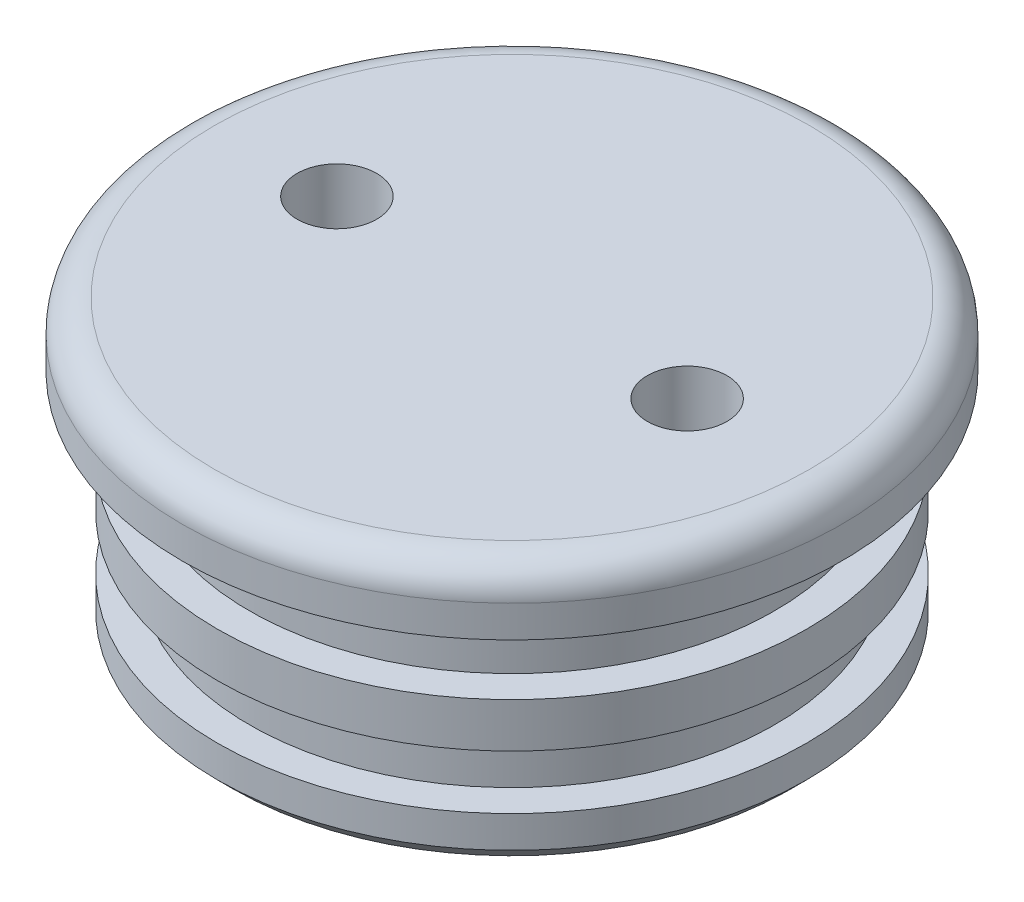
from build123d import *

# Parameters (mm, degrees)
SKETCH_1_R          = 11
EXTRUDE_1_DEPTH     = 9
SKETCH_2_R          = 0.5
CUT_EXTRUDE_1_DEPTH = 18.972200756
SKETCH_3_R          = 16.549134696
SKETCH_3_R_2        = 9.25
CUT_EXTRUDE_2_DEPTH = 7
SKETCH_4_W          = 2
SKETCH_4_H          = 1.7
SKETCH_5_W          = 5
SKETCH_5_H          = 6
CUT_EXTRUDE_3_DEPTH = 7
SKETCH_6_R          = 1.4
CUT_EXTRUDE_4_DEPTH = 7
SKETCH_7_R          = 1.25
CUT_EXTRUDE_5_DEPTH = 2.5
CUT_EXTRUDE_START   = -1.5
SKETCH_8_R          = 1.25
CUT_EXTRUDE_6_DEPTH = 1.5
SKETCH_9_W          = 7
SKETCH_9_H          = 8
SKETCH_9_W_2        = 5
SKETCH_9_H_2        = 6
CUT_EXTRUDE_7_DEPTH = 2
CHAMFER_1_SIZE      = 0.5
SKETCH_10_R         = 12.5
SKETCH_10_R_2       = 10.35
CUT_EXTRUDE_8_DEPTH = 10
FILLET_1_R          = 1
SKETCH_11_R         = 1.953999565
EXTRUDE_2_DEPTH     = 2


with BuildPart() as part:
    # 草图1 → 凸台-拉伸1 (new body)
    with BuildSketch(Plane(origin=(0, 0, 0), x_dir=(1, 0, 0), z_dir=(0, 1, 0))):
        with Locations(Location((0, 0, 0), (0, 0, 270))):
            Circle(SKETCH_1_R)
    extrude(amount=EXTRUDE_1_DEPTH)

    # 草图2 → 切除-拉伸1 (cut, through all)
    with BuildSketch(Plane(origin=(0, 9, 0), x_dir=(1, 0, 0), z_dir=(0, 1, 0))):
        with Locations(Location((-5.5, 0, 0), (0, 0, 270))):
            Circle(SKETCH_2_R)
        with Locations(Location((5.5, 0, 0), (0, 0, 270))):
            Circle(SKETCH_2_R)
    extrude(amount=-CUT_EXTRUDE_1_DEPTH, mode=Mode.SUBTRACT)

    # 草图3 → 切除-拉伸2 (cut)
    with BuildSketch(Plane.XZ):
        Circle(SKETCH_3_R)
        with Locations(Location((0, 0, 0), (0, 0, 270))):
            Circle(SKETCH_3_R_2, mode=Mode.SUBTRACT)
    extrude(amount=-CUT_EXTRUDE_2_DEPTH, mode=Mode.SUBTRACT)

    # 草图4 → 切除-旋转1 (revolve, cut)
    with BuildSketch(Plane.XY, mode=Mode.PRIVATE) as cut_revolve_1_sk:
        with Locations((-9.25, 5.45)):
            Rectangle(SKETCH_4_W, SKETCH_4_H)
        with Locations((-9.25, 2.35)):
            Rectangle(SKETCH_4_W, SKETCH_4_H)
    revolve(cut_revolve_1_sk.sketch.rotate(Axis((0, 0, 0), (0, 1, 0)), 270), axis=Axis((0, 0, 0), (0, 1, 0)), mode=Mode.SUBTRACT)

    # 草图5 → 切除-拉伸3 (cut)
    with BuildSketch(Plane.XZ):
        Rectangle(SKETCH_5_W, SKETCH_5_H)
    extrude(amount=-CUT_EXTRUDE_3_DEPTH, mode=Mode.SUBTRACT)

    # 草图6 → 切除-拉伸4 (cut)
    with BuildSketch(Plane(origin=(0, 9, 0), x_dir=(1, 0, 0), z_dir=(0, 1, 0))):
        with Locations(Location((0, 0, 0), (0, 0, 270))):
            Circle(SKETCH_6_R)
    extrude(amount=-CUT_EXTRUDE_4_DEPTH, mode=Mode.SUBTRACT)

    # 草图7 → 切除-拉伸5 (cut)
    with BuildSketch(Plane(origin=(0, 9, 0), x_dir=(1, 0, 0), z_dir=(0, 1, 0))):
        with Locations(Location((-5.5, 0, 0), (0, 0, 270))):
            Circle(SKETCH_7_R)
        with Locations(Location((5.5, 0, 0), (0, 0, 270))):
            Circle(SKETCH_7_R)
    extrude(amount=-CUT_EXTRUDE_5_DEPTH, mode=Mode.SUBTRACT)

    # 草图8 → 切除-拉伸6 (cut)
    with BuildSketch(Plane.XZ.offset(CUT_EXTRUDE_START)):
        with Locations(Location((-5.5, 0, 0), (0, 0, 90))):
            Circle(SKETCH_8_R)
        with Locations(Location((5.5, 0, 0), (0, 0, 90))):
            Circle(SKETCH_8_R)
    extrude(amount=CUT_EXTRUDE_6_DEPTH, mode=Mode.SUBTRACT)

    # 草图9 → 切除-拉伸7 (cut)
    with BuildSketch(Plane.XZ):
        Rectangle(SKETCH_9_W, SKETCH_9_H)
        Rectangle(SKETCH_9_W_2, SKETCH_9_H_2, mode=Mode.SUBTRACT)
    extrude(amount=-CUT_EXTRUDE_7_DEPTH, mode=Mode.SUBTRACT)

    # 倒角1
    chamfer_1_edges = [part.edges().sort_by_distance(p)[0] for p in [
        (0, 0, 9.25),
    ]]
    chamfer(chamfer_1_edges, length=CHAMFER_1_SIZE)

    # 草图10 → 切除-拉伸8 (cut)
    with BuildSketch(Plane(origin=(0, 9, 0), x_dir=(1, 0, 0), z_dir=(0, 1, 0))):
        Circle(SKETCH_10_R)
        with Locations(Location((0, 0, 0), (0, 0, 270))):
            Circle(SKETCH_10_R_2, mode=Mode.SUBTRACT)
    extrude(amount=-CUT_EXTRUDE_8_DEPTH, mode=Mode.SUBTRACT)

    # 圆角1
    fillet_1_edges = [part.edges().sort_by_distance(p)[0] for p in [
        (0, 9, -10.35),
    ]]
    fillet(fillet_1_edges, radius=FILLET_1_R)

    # 草图11 → 凸台-拉伸2 (add)
    with BuildSketch(Plane(origin=(0, 9, 0), x_dir=(1, 0, 0), z_dir=(0, 1, 0))):
        Circle(SKETCH_11_R)
    extrude(amount=-EXTRUDE_2_DEPTH)


solid = part.part
